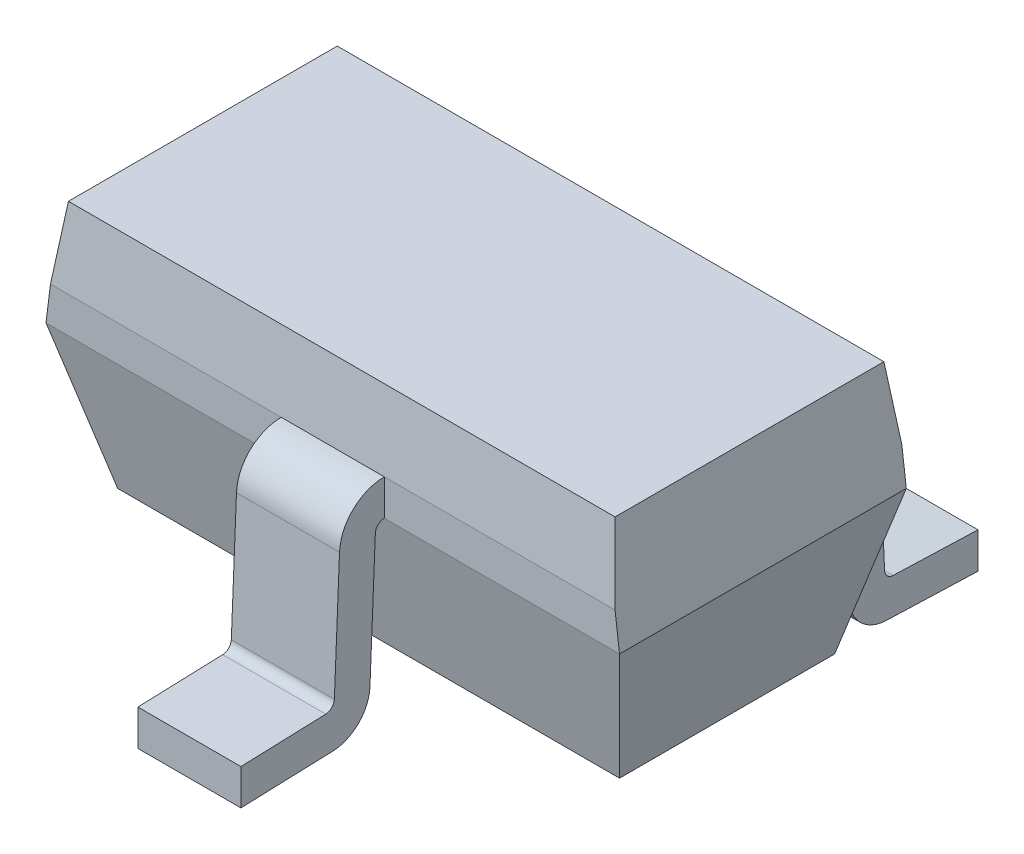
from build123d import *

# Parameters (mm, degrees)
EXTRUDE1_DEPTH          = 0.8
SKETCH2_W               = 0.65625
SKETCH2_H               = 0.4
SKETCH2_W_2             = 0.8
SKETCH2_W_3             = 0.2
CUT_EXTRUDE2_DEPTH      = 2.385640646
CUT_EXTRUDE3_DEPTH      = 2.385640646
CUT_EXTRUDE3_DEPTH_BACK = 2.385640646


with BuildPart() as part:
    # Sketch1 → Extrude1 (new, symmetric)
    with BuildSketch(Plane(origin=(0, 0, 0), x_dir=(0, 0, -1), z_dir=(1, 0, 0))):
        with BuildLine():
            Line((-0.375, 0.8), (0.375, 0.8))
            Line((0.375, 0.8), (0.4, 0.6))
            ThreePointArc((0.4, 0.6), (0.486544184, 0.565194812), (0.524893383, 0.480161667))
            Line((0.524893383, 0.480161667), (0.539273511, 0.1322154))
            ThreePointArc((0.539273511, 0.1322154), (0.546631163, 0.115513599), (0.5633797, 0.108262963))
            Line((0.5633797, 0.108262963), (0.8, 0.1))
            Line((0.8, 0.1), (0.8, 0))
            Line((0.8, 0), (0.544307795, 0.008928969))
            ThreePointArc((0.544307795, 0.008928969), (0.471836659, 0.040302567), (0.44, 0.112571477))
            Line((0.44, 0.112571477), (0.424978677, 0.476032333))
            ThreePointArc((0.424978677, 0.476032333), (0.417308837, 0.493038962), (0.4, 0.5))
            Line((0.4, 0.5), (0.3, 0.1))
            Line((0.3, 0.1), (-0.3, 0.1))
            Line((-0.3, 0.1), (-0.4, 0.5))
            ThreePointArc((-0.4, 0.5), (-0.417308837, 0.493038962), (-0.424978677, 0.476032333))
            Line((-0.424978677, 0.476032333), (-0.44, 0.112571477))
            ThreePointArc((-0.44, 0.112571477), (-0.471836659, 0.040302567), (-0.544307795, 0.008928969))
            Line((-0.544307795, 0.008928969), (-0.8, 0))
            Line((-0.8, 0), (-0.8, 0.1))
            Line((-0.8, 0.1), (-0.5633797, 0.108262963))
            ThreePointArc((-0.5633797, 0.108262963), (-0.546631163, 0.115513599), (-0.539273511, 0.1322154))
            Line((-0.539273511, 0.1322154), (-0.524893383, 0.480161667))
            ThreePointArc((-0.524893383, 0.480161667), (-0.486544184, 0.565194812), (-0.4, 0.6))
            Line((-0.4, 0.6), (-0.375, 0.8))
        make_face()
    extrude(amount=EXTRUDE1_DEPTH, both=True)

    # Sketch2 → Cut-Extrude2 (cut, through all)
    with BuildSketch(Plane(origin=(0, 0.8, 0), x_dir=(1, 0, 0), z_dir=(0, 1, 0))):
        with Locations((0.471875, -0.6)):
            Rectangle(SKETCH2_W, SKETCH2_H)
        with Locations((0, 0.6)):
            Rectangle(SKETCH2_W_2, SKETCH2_H)
        with Locations((0.7, 0.6)):
            Rectangle(SKETCH2_W_3, SKETCH2_H)
        with Locations((-0.7, 0.6)):
            Rectangle(SKETCH2_W_3, SKETCH2_H)
        with Locations((-0.471875, -0.6)):
            Rectangle(SKETCH2_W, SKETCH2_H)
    extrude(amount=-CUT_EXTRUDE2_DEPTH, mode=Mode.SUBTRACT)

    # Sketch3 → Cut-Extrude3 (cut, two sides: drawn at the far end of the back side and taken through both)
    with BuildSketch(Plane.XY.offset(-CUT_EXTRUDE3_DEPTH_BACK)):
        Polygon((-0.7, 0.1), (-0.8, 0.1), (-0.8, 0.5), align=None)
        Polygon((0.7, 0.1), (0.8, 0.1), (0.8, 0.5), align=None)
        Polygon((-0.7625, 0.8), (-0.8, 0.5), (-0.8, 0.8), align=None)
        Polygon((0.8, 0.8), (0.8, 0.5), (0.7625, 0.8), align=None)
    extrude(amount=CUT_EXTRUDE3_DEPTH + CUT_EXTRUDE3_DEPTH_BACK, mode=Mode.SUBTRACT)


solid = part.part
